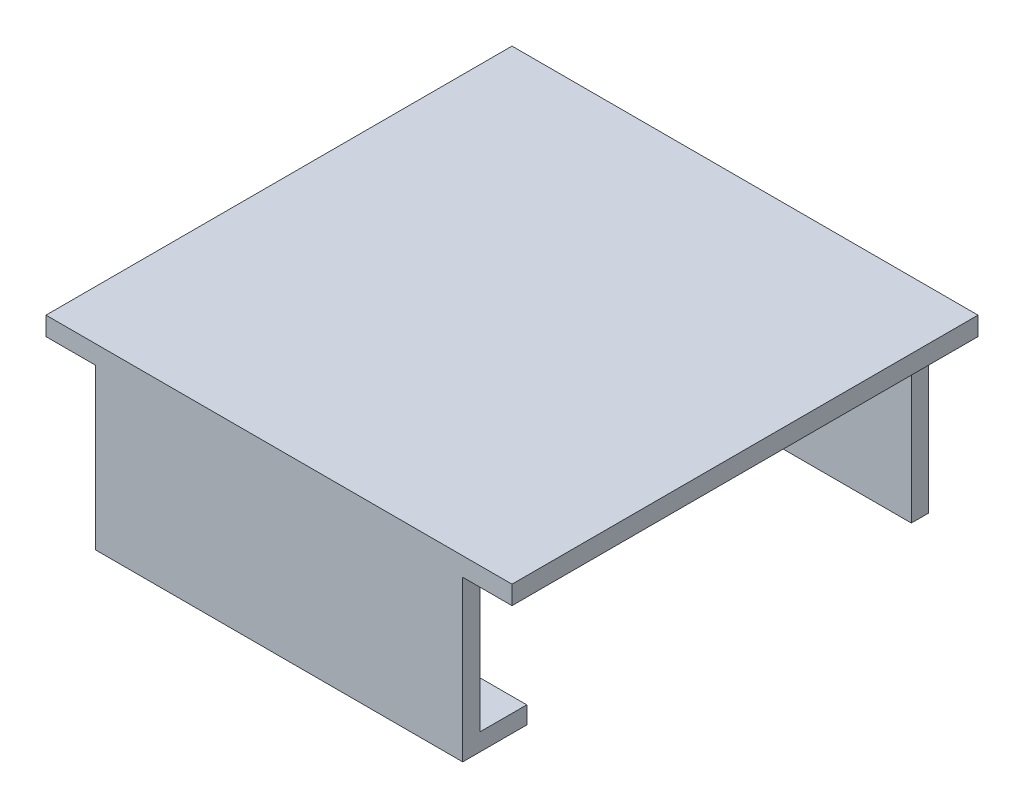
from build123d import *

# Parameters (mm, degrees)
ESQUISSE1_W          = 50
ESQUISSE1_H          = 50
BOSS_EXTRU_1_DEPTH   = 2
ESQUISSE3_W          = 39.43
ESQUISSE3_H          = 1.87
BOSS_EXTRU_2_DEPTH   = 17.16
ESQUISSE4_W          = 39.43
ESQUISSE4_H          = 1.87
BOSS_EXTRU_3_DEPTH   = 5
D_GAGEMENT_M31_D     = 3.6
D_GAGEMENT_M31_DEPTH = 1.99
D_GAGEMENT_M31_TIP   = 1.081549114
ESQUISSE7_W          = 39.43
ESQUISSE7_H          = 1.87
BOSS_EXTRU_4_DEPTH   = 1.87


with BuildPart() as part:
    # Esquisse1 → Boss.-Extru.1 (new body)
    with BuildSketch(Plane(origin=(0, 0, 0), x_dir=(1, 0, 0), z_dir=(0, 1, 0))):
        with Locations((25, 25)):
            Rectangle(ESQUISSE1_W, ESQUISSE1_H)
    extrude(amount=BOSS_EXTRU_1_DEPTH)

    # Esquisse3 → Boss.-Extru.2 (add)
    with BuildSketch(Plane.XZ):
        with Locations((25, -49.065)):
            Rectangle(ESQUISSE3_W, ESQUISSE3_H)
        with Locations((25, -0.935)):
            Rectangle(ESQUISSE3_W, ESQUISSE3_H)
    extrude(amount=BOSS_EXTRU_2_DEPTH)

    # Esquisse4 → Boss.-Extru.3 (add)
    with BuildSketch(Plane(origin=(0, 0, -1.87), x_dir=(-1, 0, 0), z_dir=(0, 0, -1))):
        with Locations((-25, -16.225)):
            Rectangle(ESQUISSE4_W, ESQUISSE4_H)
    extrude(amount=BOSS_EXTRU_3_DEPTH)

    # Dégagement M31
    with Locations(Plane(origin=(36.195, -15.29, -4.37), x_dir=(0, 0, 1), z_dir=(0, 1, 0))):
        with Locations((0, 0), (0, -22.39)):
            Hole(D_GAGEMENT_M31_D / 2, depth=D_GAGEMENT_M31_DEPTH)
            with Locations((0, 0, -(D_GAGEMENT_M31_DEPTH + D_GAGEMENT_M31_TIP / 2))):  # 118° drill point
                Cone(0, D_GAGEMENT_M31_D / 2, D_GAGEMENT_M31_TIP, mode=Mode.SUBTRACT)

    # Esquisse7 → Boss.-Extru.4 (add)
    with BuildSketch(Plane.XZ.offset(17.16)):
        with Locations((25, -49.065)):
            Rectangle(ESQUISSE7_W, ESQUISSE7_H)
    extrude(amount=BOSS_EXTRU_4_DEPTH)


solid = part.part
